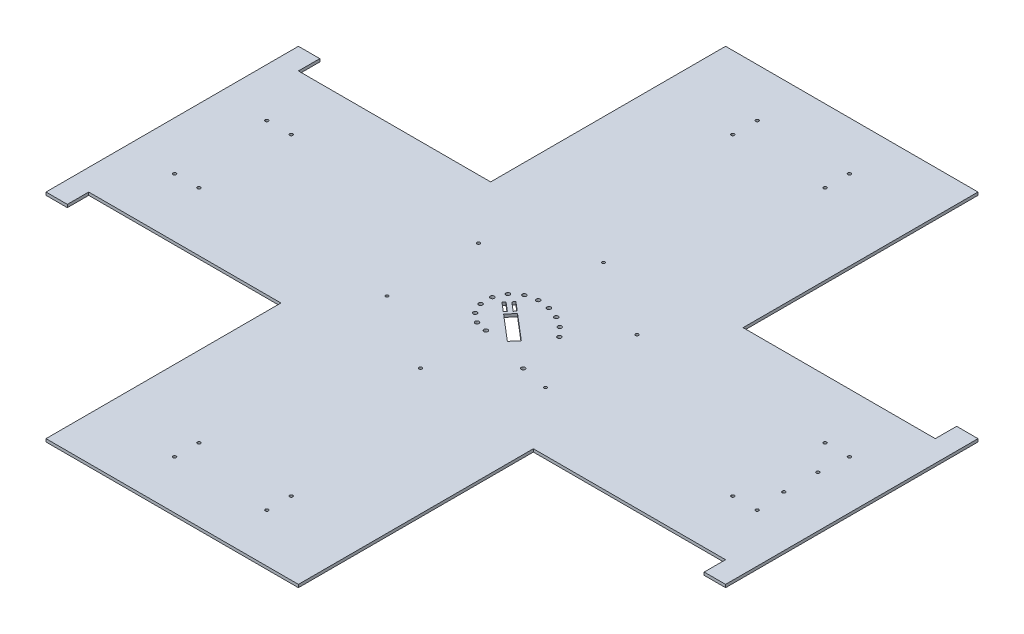
from build123d import *

# Parameters (mm, degrees)
BOSS_EXTRUDE1_DEPTH = 3
SKETCH2_R           = 1.6
CUT_EXTRUDE1_DEPTH  = 495.98383812
SKETCH3_R           = 2
SKETCH3_R_2         = 1.5
CUT_EXTRUDE2_DEPTH  = 495.98383812


with BuildPart() as part:
    # Sketch1 → Boss-Extrude1 (new body)
    with BuildSketch(Plane(origin=(0, 0, 0), x_dir=(1, 0, 0), z_dir=(0, 1, 0))):
        Polygon((-350, -130), (-328, -130), (-328, -108), (-130, -108), (-130, -130), (-130, -350), (130, -350), (130, -130), (130, -108), (328, -108), (328, -130), (350, -130), (350, 130), (328, 130), (328, 108), (130, 108), (130, 130), (130, 350), (-130, 350), (-130, 130), (-130, 108), (-328, 108), (-328, 130), (-350, 130), align=None)
    extrude(amount=BOSS_EXTRUDE1_DEPTH)

    # Sketch2 → Cut-Extrude1 (cut, through all)
    with BuildSketch(Plane(origin=(0, 3, 0), x_dir=(1, 0, 0), z_dir=(0, 1, 0))):
        with Locations(Location((-300, 47.5, 0), (0, 0, 270))):
            Circle(SKETCH2_R)
        with Locations(Location((-300, -47.5, 0), (0, 0, 270))):
            Circle(SKETCH2_R)
        with Locations(Location((-47.5, 300, 0), (0, 0, 270))):
            Circle(SKETCH2_R)
        with Locations(Location((47.5, 300, 0), (0, 0, 270))):
            Circle(SKETCH2_R)
        with Locations(Location((-47.5, -300, 0), (0, 0, 270))):
            Circle(SKETCH2_R)
        with Locations(Location((47.5, -300, 0), (0, 0, 270))):
            Circle(SKETCH2_R)
        with Locations(Location((300, 47.5, 0), (0, 0, 270))):
            Circle(SKETCH2_R)
        with Locations(Location((300, -47.5, 0), (0, 0, 270))):
            Circle(SKETCH2_R)
        with Locations(Location((-275, 47.5, 0), (0, 0, 270))):
            Circle(SKETCH2_R)
        with Locations(Location((-275, -47.5, 0), (0, 0, 270))):
            Circle(SKETCH2_R)
        with Locations(Location((-47.5, 275, 0), (0, 0, 270))):
            Circle(SKETCH2_R)
        with Locations(Location((47.5, 275, 0), (0, 0, 270))):
            Circle(SKETCH2_R)
        with Locations(Location((275, 47.5, 0), (0, 0, 270))):
            Circle(SKETCH2_R)
        with Locations(Location((275, -47.5, 0), (0, 0, 270))):
            Circle(SKETCH2_R)
        with Locations(Location((-47.5, -275, 0), (0, 0, 270))):
            Circle(SKETCH2_R)
        with Locations(Location((47.5, -275, 0), (0, 0, 270))):
            Circle(SKETCH2_R)
        with Locations(Location((297.5, 17.5, 0), (0, 0, 270))):
            Circle(SKETCH2_R)
        with Locations(Location((297.5, -17.5, 0), (0, 0, 270))):
            Circle(SKETCH2_R)
    extrude(amount=-CUT_EXTRUDE1_DEPTH, mode=Mode.SUBTRACT)

    # Sketch3 → Cut-Extrude2 (cut, through all)
    with BuildSketch(Plane(origin=(0, 3, 0), x_dir=(1, 0, 0), z_dir=(0, 1, 0))):
        with Locations(Location((0, 27, 0), (0, 0, 270))):
            Circle(SKETCH3_R)
        with Locations(Location((12.537623126, 25.500271023, 0), (0, 0, 270))):
            Circle(SKETCH3_R)
        with Locations(Location((24.394492834, 21.157941995, 0), (0, 0, 270))):
            Circle(SKETCH3_R)
        with Locations(Location((34.951700365, 14.230709518, 0), (0, 0, 270))):
            Circle(SKETCH3_R)
        with Locations(Location((43.654980033, 5.082261362, 0), (0, 0, 270))):
            Circle(SKETCH3_R)
        with Locations(Location((53.119734703, -41.583325675, 0), (0, 0, 270))):
            Circle(SKETCH3_R)
        with Locations(Location((-11.667858187, 24.348738886, 0), (0, 0, 270))):
            Circle(SKETCH3_R)
        with Locations(Location((-21.089928763, 16.858674467, 0), (0, 0, 270))):
            Circle(SKETCH3_R)
        with Locations(Location((-26.320730998, 6.018232276, 0), (0, 0, 270))):
            Circle(SKETCH3_R)
        with Locations(Location((-26.320730998, -6.018232276, 0), (0, 0, 270))):
            Circle(SKETCH3_R)
        with Locations(Location((-21.089928763, -16.858674467, 0), (0, 0, 270))):
            Circle(SKETCH3_R)
        with Locations(Location((-11.667858187, -24.348738886, 0), (0, 0, 270))):
            Circle(SKETCH3_R)
        with Locations(Location((0.0730028, -26.999901307, 0), (0, 0, 270))):
            Circle(SKETCH3_R)
        with Locations(Location((0, 94.25, 0), (0, 0, 270))):
            Circle(SKETCH3_R_2)
        with Locations(Location((81.622894307, 47.125, 0), (0, 0, 270))):
            Circle(SKETCH3_R_2)
        with Locations(Location((81.622894307, -47.125, 0), (0, 0, 270))):
            Circle(SKETCH3_R_2)
        with Locations(Location((0, -94.25, 0), (0, 0, 270))):
            Circle(SKETCH3_R_2)
        with Locations(Location((-81.622894307, -47.125, 0), (0, 0, 270))):
            Circle(SKETCH3_R_2)
        with Locations(Location((-81.622894307, 47.125, 0), (0, 0, 270))):
            Circle(SKETCH3_R_2)
        Polygon((-5.400270308, -3.253491064), (20.858357141, -25.630588384), (27.47419461, -17.867168094), (1.21556716, 4.509929225), align=None)
        Polygon((-7.683629217, -1.307656515), (-5.737794668, 0.975702394), (-14.871230302, 8.759040592), (-16.817064852, 6.475681684), align=None)
        Polygon((-3.013626298, 4.172404866), (-1.067791749, 6.455763775), (-10.201227383, 14.239101973), (-12.147061933, 11.955743064), align=None)
    extrude(amount=-CUT_EXTRUDE2_DEPTH, mode=Mode.SUBTRACT)


solid = part.part
